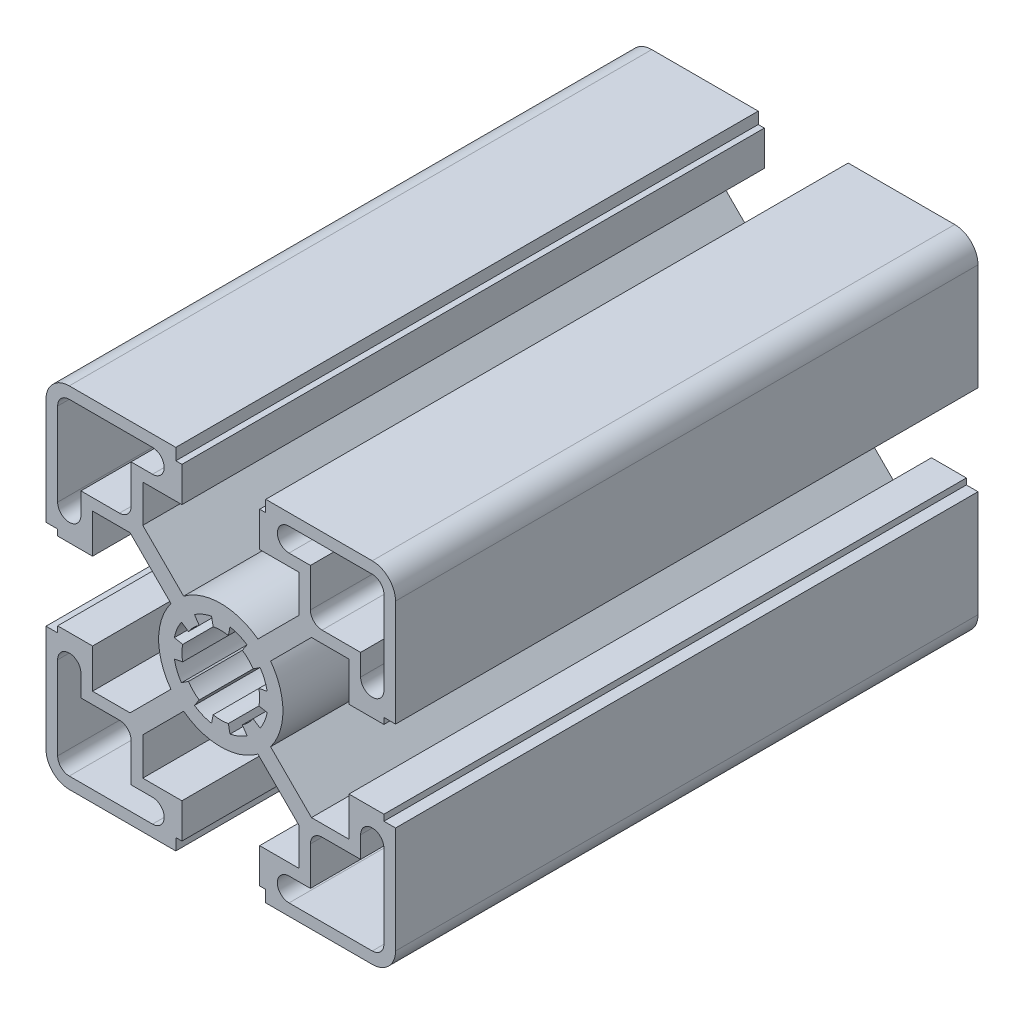
from build123d import *

# Parameters (mm, degrees)
BOSS_EXTRUDE1_DEPTH = 37.5


with BuildPart() as part:
    # Sketch1 → Boss-Extrude1 (new, symmetric)
    with BuildSketch(Plane.XY):
        with BuildLine():
            Line((-19.5072, 22.5044), (-5.7912, 22.5044))
            Line((-5.7912, 22.5044), (-5.7912, 21.0058))
            Line((-5.7912, 21.0058), (-5.0038, 21.0058))
            Line((-5.0038, 21.0058), (-5.0038, 16.51))
            Line((-5.0038, 16.51), (-10.0457, 16.51))
            Line((-10.0457, 16.51), (-10.0457, 11.680106614))
            Line((-10.0457, 11.680106614), (-4.781026704, 6.415433318))
            ThreePointArc((-4.781026704, 6.415433318), (0, 8.001), (4.781026704, 6.415433318))
            Line((4.781026704, 6.415433318), (10.0457, 11.680106614))
            Line((10.0457, 11.680106614), (10.0457, 16.51))
            Line((10.0457, 16.51), (5.0038, 16.51))
            Line((5.0038, 16.51), (5.0038, 21.0058))
            Line((5.0038, 21.0058), (5.7912, 21.0058))
            Line((5.7912, 21.0058), (5.7912, 22.5044))
            Line((5.7912, 22.5044), (19.5072, 22.5044))
            ThreePointArc((19.5072, 22.5044), (21.626540445, 21.626540445), (22.5044, 19.5072))
            Line((22.5044, 19.5072), (22.5044, 5.7912))
            Line((22.5044, 5.7912), (21.0058, 5.7912))
            Line((21.0058, 5.7912), (21.0058, 5.0038))
            Line((21.0058, 5.0038), (16.51, 5.0038))
            Line((16.51, 5.0038), (16.51, 10.0457))
            Line((16.51, 10.0457), (11.680106614, 10.0457))
            Line((11.680106614, 10.0457), (6.415433318, 4.781026704))
            ThreePointArc((6.415433318, 4.781026704), (8.001, 0), (6.415433318, -4.781026704))
            Line((6.415433318, -4.781026704), (11.680106614, -10.0457))
            Line((11.680106614, -10.0457), (16.51, -10.0457))
            Line((16.51, -10.0457), (16.51, -5.0038))
            Line((16.51, -5.0038), (21.0058, -5.0038))
            Line((21.0058, -5.0038), (21.0058, -5.7912))
            Line((21.0058, -5.7912), (22.5044, -5.7912))
            Line((22.5044, -5.7912), (22.5044, -19.5072))
            ThreePointArc((22.5044, -19.5072), (21.626540445, -21.626540445), (19.5072, -22.5044))
            Line((19.5072, -22.5044), (5.7912, -22.5044))
            Line((5.7912, -22.5044), (5.7912, -21.0058))
            Line((5.7912, -21.0058), (5.0038, -21.0058))
            Line((5.0038, -21.0058), (5.0038, -16.51))
            Line((5.0038, -16.51), (10.0457, -16.51))
            Line((10.0457, -16.51), (10.0457, -11.680106614))
            Line((10.0457, -11.680106614), (4.781026704, -6.415433318))
            ThreePointArc((4.781026704, -6.415433318), (0, -8.001), (-4.781026704, -6.415433318))
            Line((-4.781026704, -6.415433318), (-10.0457, -11.680106614))
            Line((-10.0457, -11.680106614), (-10.0457, -16.51))
            Line((-10.0457, -16.51), (-5.0038, -16.51))
            Line((-5.0038, -16.51), (-5.0038, -21.0058))
            Line((-5.0038, -21.0058), (-5.7912, -21.0058))
            Line((-5.7912, -21.0058), (-5.7912, -22.5044))
            Line((-5.7912, -22.5044), (-19.5072, -22.5044))
            ThreePointArc((-19.5072, -22.5044), (-21.626540445, -21.626540445), (-22.5044, -19.5072))
            Line((-22.5044, -19.5072), (-22.5044, -5.7912))
            Line((-22.5044, -5.7912), (-21.0058, -5.7912))
            Line((-21.0058, -5.7912), (-21.0058, -5.0038))
            Line((-21.0058, -5.0038), (-16.51, -5.0038))
            Line((-16.51, -5.0038), (-16.51, -10.0457))
            Line((-16.51, -10.0457), (-11.680106614, -10.0457))
            Line((-11.680106614, -10.0457), (-6.415433318, -4.781026704))
            ThreePointArc((-6.415433318, -4.781026704), (-8.001, 0), (-6.415433318, 4.781026704))
            Line((-6.415433318, 4.781026704), (-11.680106614, 10.0457))
            Line((-11.680106614, 10.0457), (-16.51, 10.0457))
            Line((-16.51, 10.0457), (-16.51, 5.0038))
            Line((-16.51, 5.0038), (-21.0058, 5.0038))
            Line((-21.0058, 5.0038), (-21.0058, 5.7912))
            Line((-21.0058, 5.7912), (-22.5044, 5.7912))
            Line((-22.5044, 5.7912), (-22.5044, 19.5072))
            ThreePointArc((-22.5044, 19.5072), (-21.626540445, 21.626540445), (-19.5072, 22.5044))
        make_face()
        with BuildLine():
            Line((-18.0086, 11.5443), (-13.0429, 11.5443))
            ThreePointArc((-13.0429, 11.5443), (-11.983229778, 11.983229778), (-11.5443, 13.0429))
            Line((-11.5443, 13.0429), (-11.5443, 18.0086))
            Line((-11.5443, 18.0086), (-8.7884, 18.0086))
            ThreePointArc((-8.7884, 18.0086), (-7.2898, 19.5072), (-8.7884, 21.0058))
            Line((-8.7884, 21.0058), (-19.5072, 21.0058))
            ThreePointArc((-19.5072, 21.0058), (-20.566870222, 20.566870222), (-21.0058, 19.5072))
            Line((-21.0058, 19.5072), (-21.0058, 8.7884))
            ThreePointArc((-21.0058, 8.7884), (-19.5072, 7.2898), (-18.0086, 8.7884))
            Line((-18.0086, 8.7884), (-18.0086, 11.5443))
        make_face(mode=Mode.SUBTRACT)
        with BuildLine():
            Line((1.189270603, 5.978867069), (0.976192953, 4.907653386))
            ThreePointArc((0.976192953, 4.907653386), (0, 5.0038), (-0.976192953, 4.907653386))
            Line((-0.976192953, 4.907653386), (-1.189270603, 5.978867069))
            ThreePointArc((-1.189270603, 5.978867069), (-2.332838204, 5.63196963), (-3.38675614, 5.068638757))
            Line((-3.38675614, 5.068638757), (-2.779962332, 4.160507646))
            ThreePointArc((-2.779962332, 4.160507646), (-3.538220912, 3.538220912), (-4.160507646, 2.779962332))
            Line((-4.160507646, 2.779962332), (-5.068638757, 3.38675614))
            ThreePointArc((-5.068638757, 3.38675614), (-5.63196963, 2.332838204), (-5.978867069, 1.189270603))
            Line((-5.978867069, 1.189270603), (-4.907653386, 0.976192953))
            ThreePointArc((-4.907653386, 0.976192953), (-5.0038, 0), (-4.907653386, -0.976192953))
            Line((-4.907653386, -0.976192953), (-5.978867069, -1.189270603))
            ThreePointArc((-5.978867069, -1.189270603), (-5.63196963, -2.332838204), (-5.068638757, -3.38675614))
            Line((-5.068638757, -3.38675614), (-4.160507646, -2.779962332))
            ThreePointArc((-4.160507646, -2.779962332), (-3.538220912, -3.538220912), (-2.779962332, -4.160507646))
            Line((-2.779962332, -4.160507646), (-3.38675614, -5.068638757))
            ThreePointArc((-3.38675614, -5.068638757), (-2.332838204, -5.63196963), (-1.189270603, -5.978867069))
            Line((-1.189270603, -5.978867069), (-0.976192953, -4.907653386))
            ThreePointArc((-0.976192953, -4.907653386), (0, -5.0038), (0.976192953, -4.907653386))
            Line((0.976192953, -4.907653386), (1.189270603, -5.978867069))
            ThreePointArc((1.189270603, -5.978867069), (2.332838204, -5.63196963), (3.38675614, -5.068638757))
            Line((3.38675614, -5.068638757), (2.779962332, -4.160507646))
            ThreePointArc((2.779962332, -4.160507646), (3.538220912, -3.538220912), (4.160507646, -2.779962332))
            Line((4.160507646, -2.779962332), (5.068638757, -3.38675614))
            ThreePointArc((5.068638757, -3.38675614), (5.63196963, -2.332838204), (5.978867069, -1.189270603))
            Line((5.978867069, -1.189270603), (4.907653386, -0.976192953))
            ThreePointArc((4.907653386, -0.976192953), (5.0038, 0), (4.907653386, 0.976192953))
            Line((4.907653386, 0.976192953), (5.978867069, 1.189270603))
            ThreePointArc((5.978867069, 1.189270603), (5.63196963, 2.332838204), (5.068638757, 3.38675614))
            Line((5.068638757, 3.38675614), (4.160507646, 2.779962332))
            ThreePointArc((4.160507646, 2.779962332), (3.538220912, 3.538220912), (2.779962332, 4.160507646))
            Line((2.779962332, 4.160507646), (3.38675614, 5.068638757))
            ThreePointArc((3.38675614, 5.068638757), (2.332838204, 5.63196963), (1.189270603, 5.978867069))
        make_face(mode=Mode.SUBTRACT)
        with BuildLine():
            Line((11.5443, 18.0086), (8.7884, 18.0086))
            ThreePointArc((8.7884, 18.0086), (7.2898, 19.5072), (8.7884, 21.0058))
            Line((8.7884, 21.0058), (19.5072, 21.0058))
            ThreePointArc((19.5072, 21.0058), (20.566870222, 20.566870222), (21.0058, 19.5072))
            Line((21.0058, 19.5072), (21.0058, 8.7884))
            ThreePointArc((21.0058, 8.7884), (19.5072, 7.2898), (18.0086, 8.7884))
            Line((18.0086, 8.7884), (18.0086, 11.5443))
            Line((18.0086, 11.5443), (13.0429, 11.5443))
            ThreePointArc((13.0429, 11.5443), (11.983229778, 11.983229778), (11.5443, 13.0429))
            Line((11.5443, 13.0429), (11.5443, 18.0086))
        make_face(mode=Mode.SUBTRACT)
        with BuildLine():
            Line((18.0086, -11.5443), (13.0429, -11.5443))
            ThreePointArc((13.0429, -11.5443), (11.983229778, -11.983229778), (11.5443, -13.0429))
            Line((11.5443, -13.0429), (11.5443, -18.0086))
            Line((11.5443, -18.0086), (8.7884, -18.0086))
            ThreePointArc((8.7884, -18.0086), (7.2898, -19.5072), (8.7884, -21.0058))
            Line((8.7884, -21.0058), (19.5072, -21.0058))
            ThreePointArc((19.5072, -21.0058), (20.566870222, -20.566870222), (21.0058, -19.5072))
            Line((21.0058, -19.5072), (21.0058, -8.7884))
            ThreePointArc((21.0058, -8.7884), (19.5072, -7.2898), (18.0086, -8.7884))
            Line((18.0086, -8.7884), (18.0086, -11.5443))
        make_face(mode=Mode.SUBTRACT)
        with BuildLine():
            Line((-11.5443, -18.0086), (-8.7884, -18.0086))
            ThreePointArc((-8.7884, -18.0086), (-7.2898, -19.5072), (-8.7884, -21.0058))
            Line((-8.7884, -21.0058), (-19.5072, -21.0058))
            ThreePointArc((-19.5072, -21.0058), (-20.566870222, -20.566870222), (-21.0058, -19.5072))
            Line((-21.0058, -19.5072), (-21.0058, -8.7884))
            ThreePointArc((-21.0058, -8.7884), (-19.5072, -7.2898), (-18.0086, -8.7884))
            Line((-18.0086, -8.7884), (-18.0086, -11.5443))
            Line((-18.0086, -11.5443), (-13.0429, -11.5443))
            ThreePointArc((-13.0429, -11.5443), (-11.983229778, -11.983229778), (-11.5443, -13.0429))
            Line((-11.5443, -13.0429), (-11.5443, -18.0086))
        make_face(mode=Mode.SUBTRACT)
    extrude(amount=BOSS_EXTRUDE1_DEPTH, both=True)


solid = part.part
